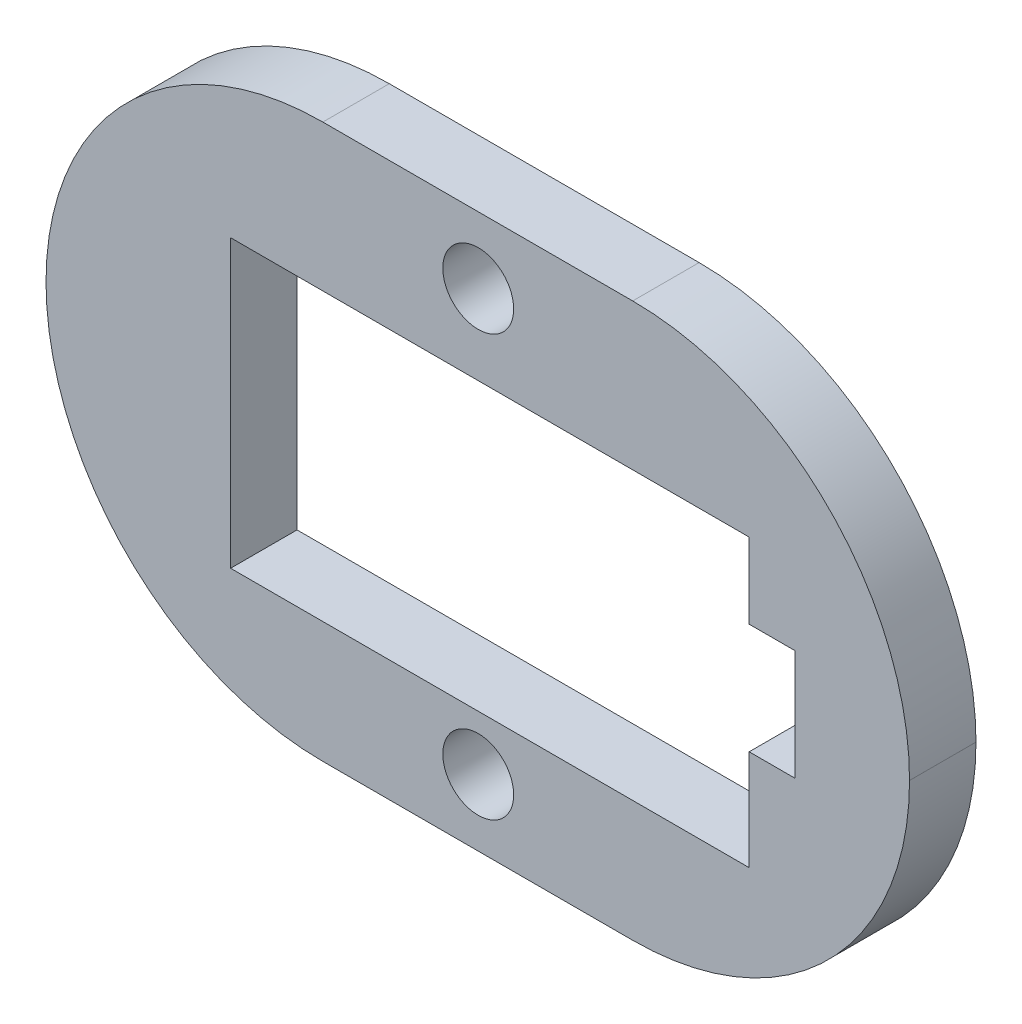
from build123d import *

# Parameters (mm, degrees)
SKETCH_1_R          = 1.3
EXTRUDE_1_DEPTH     = 3
SKETCH_2_R          = 1.6
CUT_EXTRUDE_1_DEPTH = 33.790082592
CHAMFER_1_SIZE      = 0.3


with BuildPart() as part:
    # 草图1 → 凸台-拉伸1 (new body)
    with BuildSketch(Plane(origin=(0, 0, 0), x_dir=(-1, 0, 0), z_dir=(0, 0, -1))):
        with BuildLine():
            Line((8.503321513, 25.001), (-5.486589193, 25.001))
            ThreePointArc((-5.486589193, 25.001), (-14.325423958, 21.339834765), (-17.986589193, 12.501))
            Line((-17.986589193, 12.501), (-17.986589193, 12.5))
            ThreePointArc((-17.986589193, 12.5), (-14.325423958, 3.661165235), (-5.486589193, 0))
            Line((-5.486589193, 0), (8.503321493, 0))
            ThreePointArc((8.503321493, 0), (17.342156257, 3.661165235), (21.003321493, 12.5))
            ThreePointArc((21.003321493, 12.5), (17.342509831, 21.339481206), (8.503321513, 25.001))
        make_face()
        with Locations(Location((1.487905971, 21.9995, 0), (0, 0, 180))):
            Circle(SKETCH_1_R, mode=Mode.SUBTRACT)
        with Locations(Location((1.487905971, 2.9995, 0), (0, 0, 180))):
            Circle(SKETCH_1_R, mode=Mode.SUBTRACT)
        Polygon((-12.805414109, 14.989684765), (-10.744590409, 14.989684765), (-10.744590409, 18.396106406), (12.668734206, 18.396106406), (12.668734206, 5.470232129), (-10.744590409, 5.470232129), (-10.744590409, 10.001), (-12.805414109, 10.001), align=None, mode=Mode.SUBTRACT)
    extrude(amount=-EXTRUDE_1_DEPTH)

    # 草图2 → 切除-拉伸1 (cut, through all)
    with BuildSketch(Plane.XY.offset(3)):
        with Locations((-1.487905971, 21.9995)):
            Circle(SKETCH_2_R)
        with Locations((-1.487905971, 2.9995)):
            Circle(SKETCH_2_R)
    extrude(amount=-CUT_EXTRUDE_1_DEPTH, mode=Mode.SUBTRACT)

    # 倒角1
    chamfer_1_edges = [part.edges().sort_by_distance(p)[0] for p in [
        (-3.087905971, 21.9995, 0),
        (-3.087905971, 2.9995, 0),
    ]]
    chamfer(chamfer_1_edges, length=CHAMFER_1_SIZE)


solid = part.part
